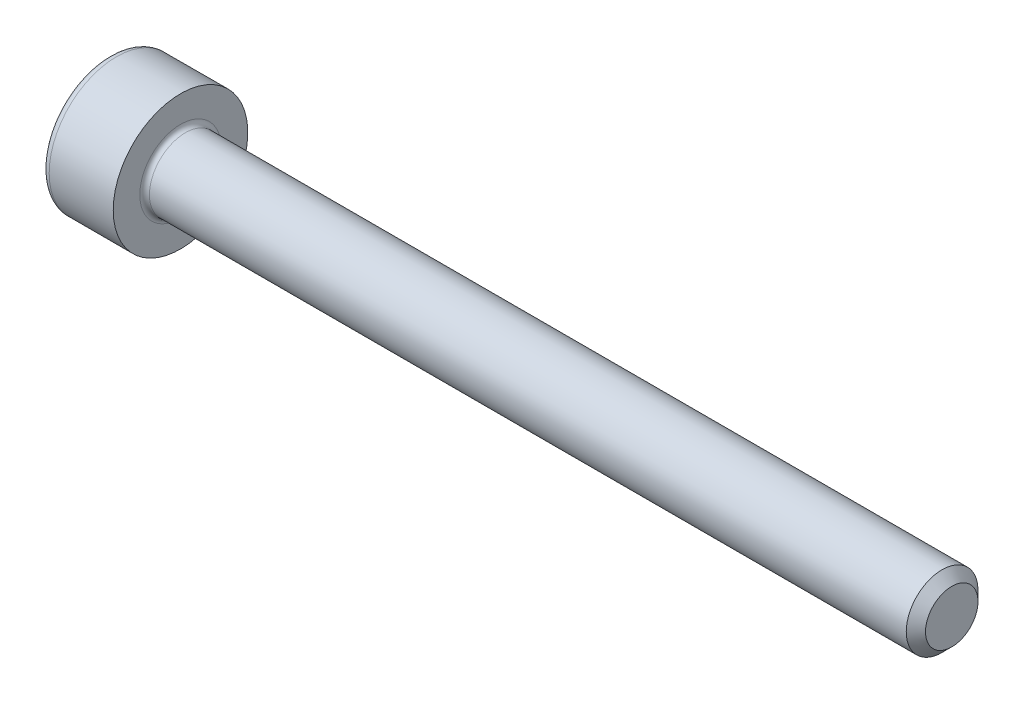
from build123d import *

# Parameters (mm, degrees)
FILLET1_R      = 0.1
FILLET2_R      = 0.16
CHAMFER1_SIZE  = 0.2
EXTRUDE1_DEPTH = 0.7


with BuildPart() as part:
    # Sketch1 → Revolve1 (revolve)
    with BuildSketch(Plane.XY):
        Polygon((0, 1.395688245), (0, 0), (17.488734128, 0), (17.488734128, 0.744367064), (1.488734128, 0.744367064), (1.488734128, 1.395688245), align=None)
    revolve(axis=Axis((0, 0, 0), (1, 0, 0)))

    # Fillet1
    fillet1_edges = [part.edges().sort_by_distance(p)[0] for p in [
        (1.488734128, -0.744367064, 0),
    ]]
    fillet(fillet1_edges, radius=FILLET1_R)

    # Fillet2
    fillet2_edges = [part.edges().sort_by_distance(p)[0] for p in [
        (0, -1.395688245, 0),
    ]]
    fillet(fillet2_edges, radius=FILLET2_R)

    # Chamfer1
    chamfer1_edges = [part.edges().sort_by_distance(p)[0] for p in [
        (17.488734128, -0.744367064, 0),
    ]]
    chamfer(chamfer1_edges, length=CHAMFER1_SIZE)

    # Sketch2 → Extrude1 (cut)
    with BuildSketch(Plane.ZY):
        Polygon((0, 0.877572409), (-0.76, 0.438786205), (-0.76, -0.438786205), (0, -0.877572409), (0.76, -0.438786205), (0.76, 0.438786205), align=None)
    extrude(amount=-EXTRUDE1_DEPTH, mode=Mode.SUBTRACT)


solid = part.part
